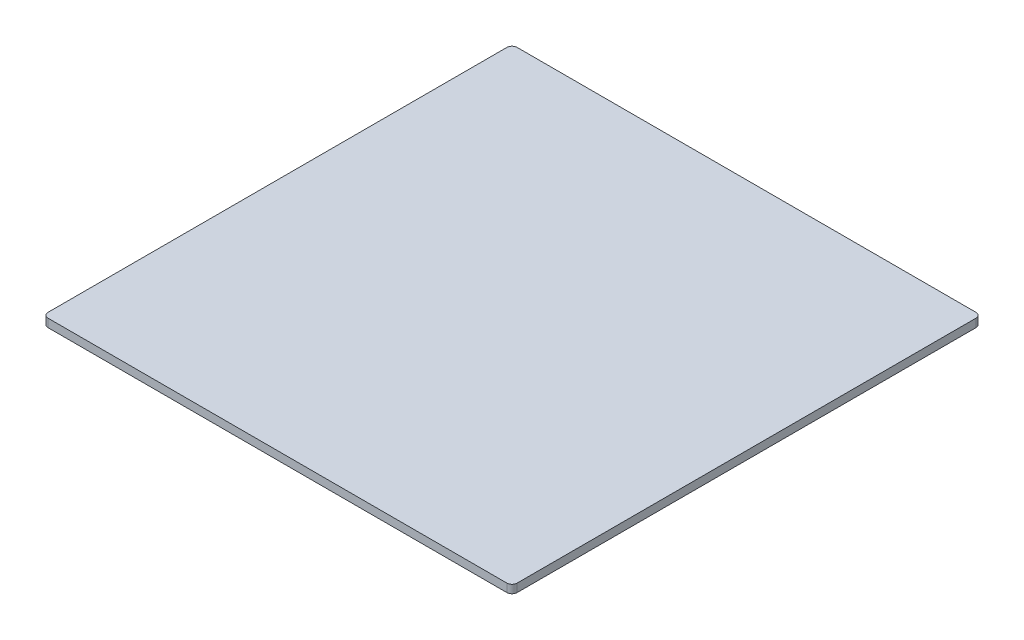
from build123d import *

# Parameters (mm, degrees)
BOSS_EXTRUDE1_DEPTH = 1.6


with BuildPart() as part:
    # Sketch1 → Boss-Extrude1 (new body)
    with BuildSketch(Plane(origin=(0, 0, 0), x_dir=(1, 0, 0), z_dir=(0, 1, 0))):
        with BuildLine():
            Line((-44.5, -45.5), (44.5, -45.5))
            ThreePointArc((44.5, -45.5), (45.207106781, -45.207106781), (45.5, -44.5))
            Line((45.5, -44.5), (45.5, 44.5))
            ThreePointArc((45.5, 44.5), (45.207106781, 45.207106781), (44.5, 45.5))
            Line((44.5, 45.5), (-44.5, 45.5))
            ThreePointArc((-44.5, 45.5), (-45.207106781, 45.207106781), (-45.5, 44.5))
            Line((-45.5, 44.5), (-45.5, -44.5))
            ThreePointArc((-45.5, -44.5), (-45.207106781, -45.207106781), (-44.5, -45.5))
        make_face()
    extrude(amount=-BOSS_EXTRUDE1_DEPTH)


solid = part.part
